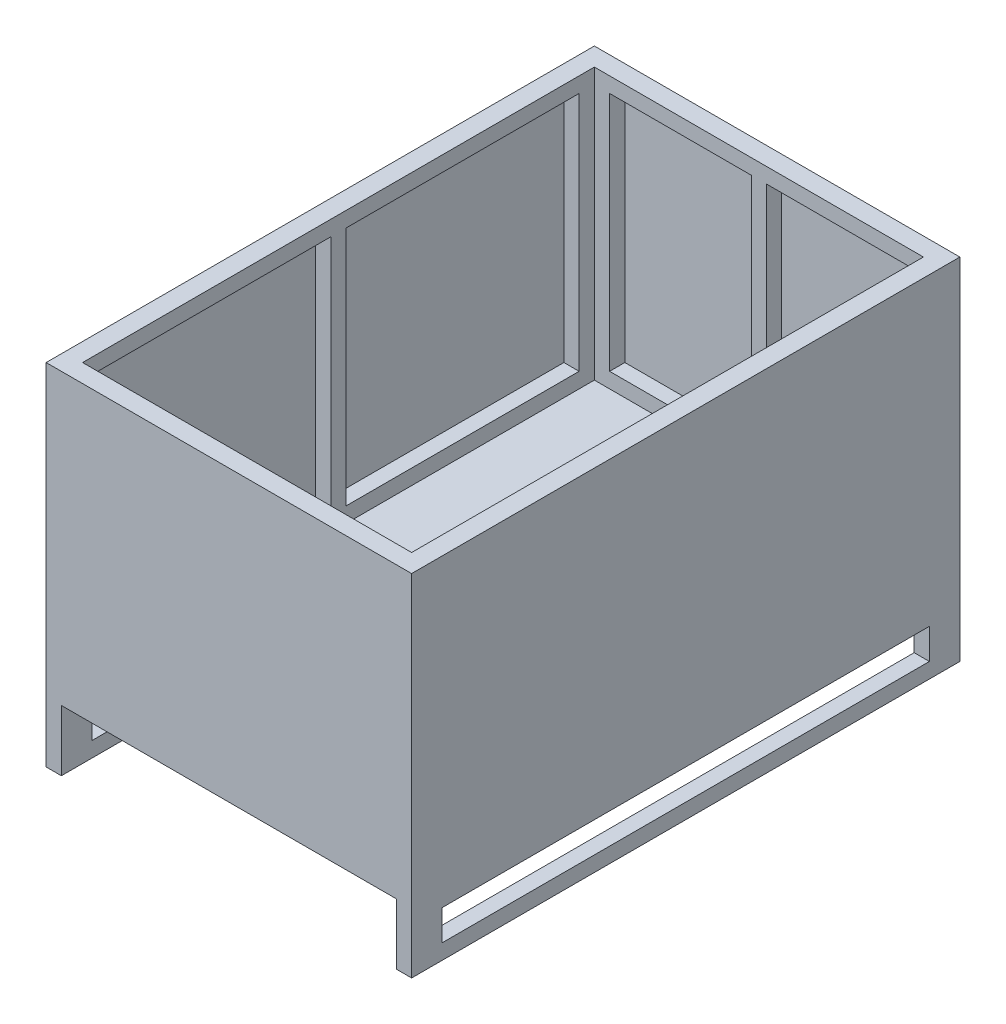
from build123d import *

# Parameters (mm, degrees)
SKETCH1_W            = 609.6
SKETCH1_H            = 457.2
BOSS_EXTRUDE1_DEPTH  = 5
SKETCH2_W            = 5
SKETCH2_H            = 914.4
BOSS_EXTRUDE2_DEPTH  = 457.2
SKETCH3_W            = 609.6
SKETCH3_H            = 457.2
BOSS_EXTRUDE3_DEPTH  = 5
SKETCH4_W            = 914.4
SKETCH4_H            = 457.2
BOSS_EXTRUDE4_DEPTH  = 5
SKETCH5_W            = 609.6
SKETCH5_H            = 914.4
BOSS_EXTRUDE5_DEPTH  = 5
SKETCH6_W            = 609.6
SKETCH6_H            = 914.4
SKETCH6_W_2          = 558.8
SKETCH6_H_2          = 863.6
BOSS_EXTRUDE6_DEPTH  = 25.4
SKETCH7_W            = 25.4
SKETCH7_H            = 863.6
BOSS_EXTRUDE7_DEPTH  = 25.4
SKETCH10_W           = 904.4
SKETCH10_H           = 452.2
SKETCH10_W_2         = 853.6
SKETCH10_H_2         = 401.4
BOSS_EXTRUDE8_DEPTH  = 25.4
SKETCH22_W           = 548.8
SKETCH22_H           = 452.2
SKETCH22_W_2         = 236.3
SKETCH22_H_2         = 401.4
BOSS_EXTRUDE14_DEPTH = 25.4
SKETCH15_W           = 25.4
SKETCH15_H           = 401.4
BOSS_EXTRUDE15_DEPTH = 25.4
SKETCH23_W           = 25.4
SKETCH23_H           = 401.4
BOSS_EXTRUDE16_DEPTH = 25.4
SKETCH17_W           = 914.4
SKETCH17_H           = 101.6
SKETCH17_W_2         = 812.8
SKETCH17_H_2         = 50.8
BOSS_EXTRUDE17_DEPTH = 25.4
SKETCH25_W           = 25.4
SKETCH25_H           = 863.6
CUT_EXTRUDE1_DEPTH   = 25.4
SKETCH26_W           = 558.8
SKETCH26_H           = 25.4
BOSS_EXTRUDE18_DEPTH = 25.4


with BuildPart() as part:
    # Sketch1 → Boss-Extrude1 (new body)
    with BuildSketch(Plane.XY):
        with Locations((304.8, 228.6)):
            Rectangle(SKETCH1_W, SKETCH1_H)
    extrude(amount=BOSS_EXTRUDE1_DEPTH)

    # Sketch2 → Boss-Extrude2 (add)
    with BuildSketch(Plane(origin=(0, 0, 0), x_dir=(1, 0, 0), z_dir=(0, 1, 0))):
        with Locations((2.5, 452.2)):
            Rectangle(SKETCH2_W, SKETCH2_H)
    extrude(amount=BOSS_EXTRUDE2_DEPTH)

    # Sketch3 → Boss-Extrude3 (add)
    with BuildSketch(Plane(origin=(0, 0, -909.4), x_dir=(-1, 0, 0), z_dir=(0, 0, -1))):
        with Locations((-304.8, 228.6)):
            Rectangle(SKETCH3_W, SKETCH3_H)
    extrude(amount=-BOSS_EXTRUDE3_DEPTH)

    # Sketch4 → Boss-Extrude4 (add)
    with BuildSketch(Plane(origin=(609.6, 0, 0), x_dir=(0, 0, -1), z_dir=(1, 0, 0))):
        with Locations((452.2, 228.6)):
            Rectangle(SKETCH4_W, SKETCH4_H)
    extrude(amount=-BOSS_EXTRUDE4_DEPTH)

    # Sketch5 → Boss-Extrude5 (add)
    with BuildSketch(Plane(origin=(0, 0, 0), x_dir=(-1, 0, 0), z_dir=(0, -1, 0))):
        with Locations((-304.8, 452.2)):
            Rectangle(SKETCH5_W, SKETCH5_H)
    extrude(amount=-BOSS_EXTRUDE5_DEPTH)

    # Sketch6 → Boss-Extrude6 (add)
    with BuildSketch(Plane.XZ):
        with Locations((304.8, -452.2)):
            Rectangle(SKETCH6_W, SKETCH6_H)
        with Locations((304.8, -452.2)):
            Rectangle(SKETCH6_W_2, SKETCH6_H_2, mode=Mode.SUBTRACT)
    extrude(amount=BOSS_EXTRUDE6_DEPTH)

    # Sketch7 → Boss-Extrude7 (add)
    with BuildSketch(Plane.XZ):
        with Locations((304.8, -452.2)):
            Rectangle(SKETCH7_W, SKETCH7_H)
    extrude(amount=BOSS_EXTRUDE7_DEPTH)

    # Sketch10 → Boss-Extrude8 (add)
    with BuildSketch(Plane.ZY.offset(-604.6)):
        with Locations((-452.2, 231.1)):
            Rectangle(SKETCH10_W, SKETCH10_H)
        with Locations((-452.2, 231.1)):
            Rectangle(SKETCH10_W_2, SKETCH10_H_2, mode=Mode.SUBTRACT)
    extrude(amount=BOSS_EXTRUDE8_DEPTH)


with BuildPart() as body_2:
    # Mirror3: mirrored copy
    add(part.part.mirror(Plane(origin=(304.8, 457.2, -904.4), x_dir=(0, 0, 1), z_dir=(1, 0, 0))))


with BuildPart() as part_1:
    add(part.part)

    add(body_2.part)  # Boss-Extrude14 merges body 2
    # Sketch22 → Boss-Extrude14 (add)
    with BuildSketch(Plane.XY.offset(-904.4)):
        with Locations((304.8, 231.1)):
            Rectangle(SKETCH22_W, SKETCH22_H)
        with Locations((173.95, 231.1)):
            Rectangle(SKETCH22_W_2, SKETCH22_H_2, mode=Mode.SUBTRACT)
        with Locations((435.65, 231.1)):
            Rectangle(SKETCH22_W_2, SKETCH22_H_2, mode=Mode.SUBTRACT)
    extrude(amount=BOSS_EXTRUDE14_DEPTH)

    # Sketch15 → Boss-Extrude15 (add)
    with BuildSketch(Plane(origin=(5, 0, 0), x_dir=(0, 0, -1), z_dir=(1, 0, 0))):
        with Locations((38.1, 231.1)):
            Rectangle(SKETCH15_W, SKETCH15_H)
        with Locations((866.3, 231.1)):
            Rectangle(SKETCH15_W, SKETCH15_H)
        with Locations((452.2, 231.1)):
            Rectangle(SKETCH15_W, SKETCH15_H)
    extrude(amount=BOSS_EXTRUDE15_DEPTH)

    # Sketch23 → Boss-Extrude16 (add)
    with BuildSketch(Plane.ZY.offset(-604.6)):
        with Locations((-38.1, 231.1)):
            Rectangle(SKETCH23_W, SKETCH23_H)
        with Locations((-452.2, 231.1)):
            Rectangle(SKETCH23_W, SKETCH23_H)
        with Locations((-866.3, 231.1)):
            Rectangle(SKETCH23_W, SKETCH23_H)
    extrude(amount=BOSS_EXTRUDE16_DEPTH)

    # Mirror9: part across plane


with BuildPart() as part_2:
    add(part_1.part)
    add(part_1.part.mirror(Plane.XY.offset(-452.2)))

    # Sketch17 → Boss-Extrude17 (add)
    with BuildSketch(Plane(origin=(0, 0, 5), x_dir=(0, 0, -1), z_dir=(1, 0, 0))):
        with Locations((457.2, -76.2)):
            Rectangle(SKETCH17_W, SKETCH17_H)
        with Locations((457.2, -76.2)):
            Rectangle(SKETCH17_W_2, SKETCH17_H_2, mode=Mode.SUBTRACT)
    extrude(amount=BOSS_EXTRUDE17_DEPTH)

    # Mirror10: part across plane


with BuildPart() as part_3:
    add(part_2.part)
    add(part_2.part.mirror(Plane(origin=(304.8, 457.2, -904.4), x_dir=(0, 0, 1), z_dir=(1, 0, 0))))

    # Sketch25 → Cut-Extrude1 (cut)
    with BuildSketch(Plane.XZ.offset(25.4)):
        with Locations((304.8, -452.2)):
            Rectangle(SKETCH25_W, SKETCH25_H)
    extrude(amount=-CUT_EXTRUDE1_DEPTH, mode=Mode.SUBTRACT)

    # Sketch26 → Boss-Extrude18 (add)
    with BuildSketch(Plane.XZ):
        with Locations((304.8, -452.2)):
            Rectangle(SKETCH26_W, SKETCH26_H)
    extrude(amount=BOSS_EXTRUDE18_DEPTH)


solid = part_3.part
